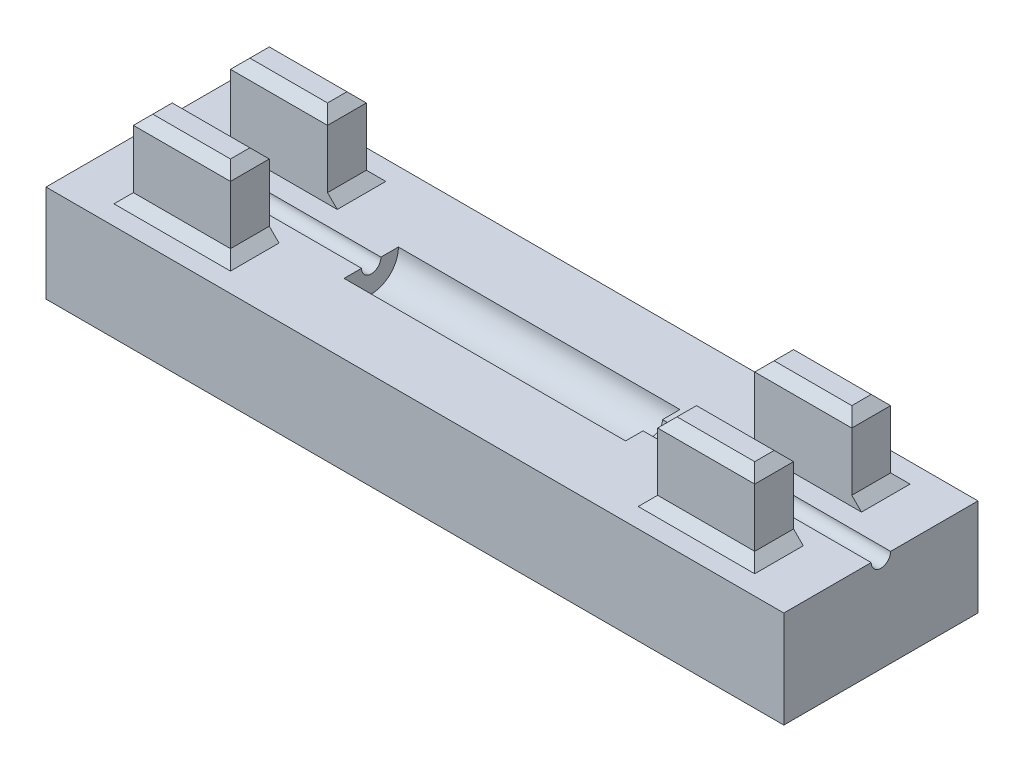
from build123d import *

# Parameters (mm, degrees)
SKETCH1_W           = 38
SKETCH1_H           = 10
BOSS_EXTRUDE1_DEPTH = 5
SKETCH3_W           = 5
SKETCH3_H           = 2
BOSS_EXTRUDE2_DEPTH = 4
CHAMFER1_SIZE       = 0.5
CHAMFER2_SIZE       = 0.5


with BuildPart() as part:
    # Sketch1 → Boss-Extrude1 (new body)
    with BuildSketch(Plane(origin=(0, 0, 0), x_dir=(1, 0, 0), z_dir=(0, 1, 0))):
        with Locations((19, 5)):
            Rectangle(SKETCH1_W, SKETCH1_H)
    extrude(amount=BOSS_EXTRUDE1_DEPTH)

    # Sketch2 → Cut-Revolve1 (revolve, cut)
    with BuildSketch(Plane(origin=(0, 5, 0), x_dir=(1, 0, 0), z_dir=(0, 1, 0))):
        Polygon((0, 5), (38, 5), (38, 4.5), (26.25, 4.5), (26.25, 3.6), (11.75, 3.6), (11.75, 4.5), (0, 4.5), align=None)
    revolve(axis=Axis((0, 5, -5), (1, 0, 0)), mode=Mode.SUBTRACT)

    # Sketch3 → Boss-Extrude2 (add)
    with BuildSketch(Plane(origin=(0, 5, 0), x_dir=(1, 0, 0), z_dir=(0, 1, 0))):
        with Locations((5.5, 7.5)):
            Rectangle(SKETCH3_W, SKETCH3_H)
        with Locations((32.5, 7.5)):
            Rectangle(SKETCH3_W, SKETCH3_H)
        with Locations((32.5, 2.500985925)):
            Rectangle(SKETCH3_W, SKETCH3_H)
        with Locations((5.5, 2.500985925)):
            Rectangle(SKETCH3_W, SKETCH3_H)
    extrude(amount=BOSS_EXTRUDE2_DEPTH)

    # Chamfer1
    chamfer1_edges = [part.edges().sort_by_distance(p)[0] for p in [
        (3, 5, -7.5),
        (8, 5, -7.5),
        (5.5, 5, -8.5),
        (30, 5, -7.5),
        (35, 5, -7.5),
        (32.5, 5, -8.5),
        (30, 5, -2.500985925),
        (32.5, 5, -1.500985925),
        (35, 5, -2.500985925),
        (3, 5, -2.500985925),
        (5.5, 5, -1.500985925),
        (8, 5, -2.500985925),
    ]]
    chamfer(chamfer1_edges, length=CHAMFER1_SIZE)

    # Chamfer2
    chamfer2_edges = [part.edges().sort_by_distance(p)[0] for p in [
        (3, 9, -7.5),
        (5.5, 9, -6.5),
        (8, 9, -7.5),
        (5.5, 9, -8.5),
        (30, 9, -7.5),
        (32.5, 9, -6.5),
        (35, 9, -7.5),
        (32.5, 9, -8.5),
        (30, 9, -2.500985925),
        (32.5, 9, -1.500985925),
        (35, 9, -2.500985925),
        (32.5, 9, -3.500985925),
        (3, 9, -2.500985925),
        (5.5, 9, -1.500985925),
        (8, 9, -2.500985925),
        (5.5, 9, -3.500985925),
    ]]
    chamfer(chamfer2_edges, length=CHAMFER2_SIZE)


solid = part.part
